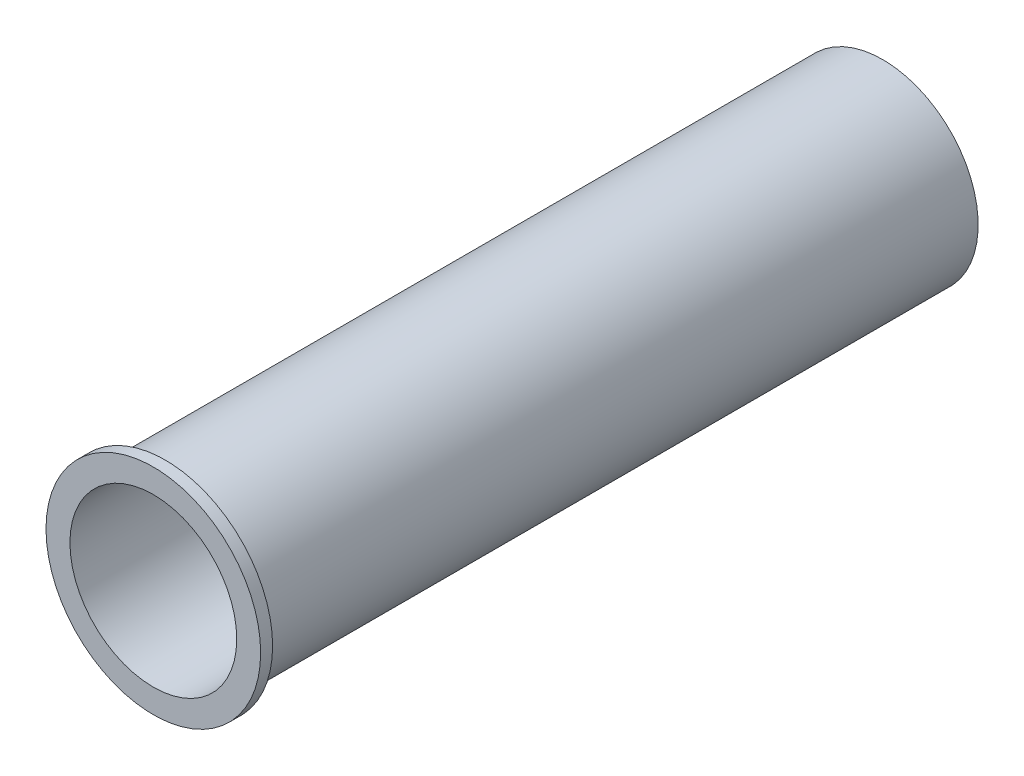
from build123d import *


with BuildPart() as part:
    # Croquis1 → Revolución1 (revolve)
    with BuildSketch(Plane.YZ, mode=Mode.PRIVATE) as revoluci_n1_sk:
        Polygon((13.95, -60), (13.95, 60), (17.95, 60), (17.95, 58), (15.95, 58), (15.95, -62), (12.45, -62), (12.45, -60), align=None)
    revolve(revoluci_n1_sk.sketch.rotate(Axis((0, 0, 0), (0, 0, 1)), 90), axis=Axis((0, 0, 0), (0, 0, 1)))


solid = part.part
